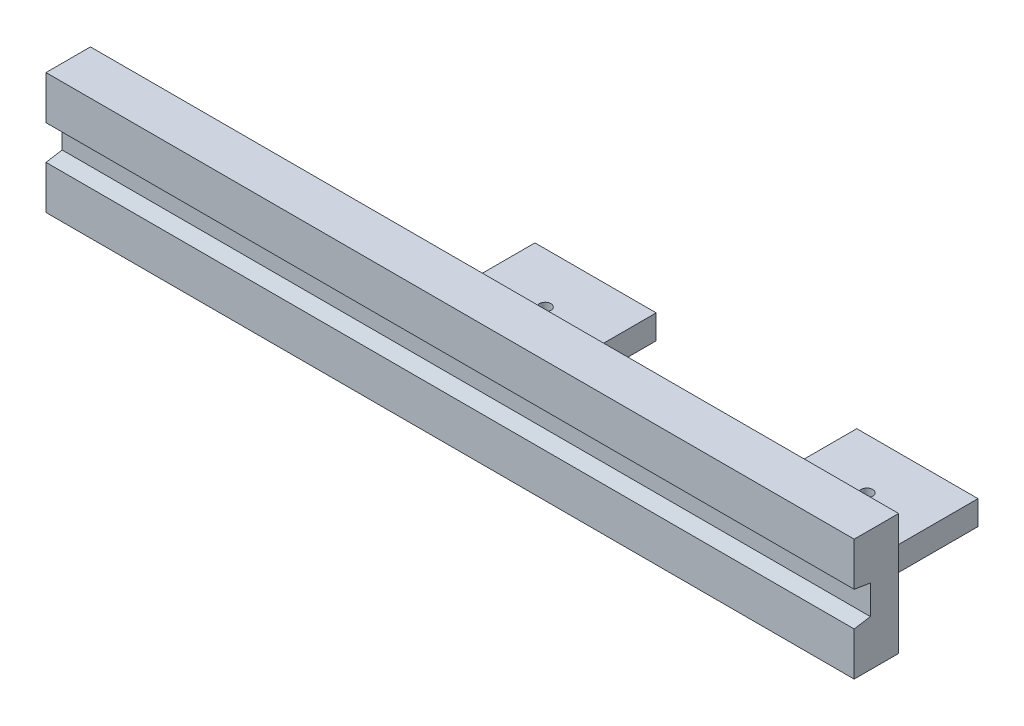
from build123d import *

# Parameters (mm, degrees)
SKETCH_1_W          = 200
SKETCH_1_H          = 30
EXTRUDE_1_DEPTH     = 11
SKETCH_4_W          = 15
SKETCH_4_H          = 3
EXTRUDE_2_DEPTH     = 25
CUT_EXTRUDE_2_DEPTH = 204.776838723
CUT_EXTRUDE_3_DEPTH = 203.358592602
SKETCH_9_W          = 30
SKETCH_9_H          = 6
EXTRUDE_3_DEPTH     = 25
CUT_EXTRUDE_4_DEPTH = 203.358592602


with BuildPart() as part:
    # 草圖1 → 填料-伸長1 (new body)
    with BuildSketch(Plane.XY):
        with Locations((100, 15)):
            Rectangle(SKETCH_1_W, SKETCH_1_H)
    extrude(amount=EXTRUDE_1_DEPTH)

    # 草圖4 → 填料-伸長2 (add)
    with BuildSketch(Plane(origin=(0, 0, 0), x_dir=(-1, 0, 0), z_dir=(0, 0, -1))):
        with Locations((-107.5, 13.5)):
            Rectangle(SKETCH_4_W, SKETCH_4_H)
        with Locations((-107.5, 16.5)):
            Rectangle(SKETCH_4_W, SKETCH_4_H)
        with Locations((-92.5, 16.5)):
            Rectangle(SKETCH_4_W, SKETCH_4_H)
        with Locations((-92.5, 13.5)):
            Rectangle(SKETCH_4_W, SKETCH_4_H)
    extrude(amount=EXTRUDE_2_DEPTH)

    # 草圖5 → 除料-伸長2 (cut, through all)
    with BuildSketch(Plane(origin=(200, 0, 0), x_dir=(0, 0, -1), z_dir=(1, 0, 0))):
        Polygon((-11, 15), (-7, 15), (-7, 18.6), (-11, 19.25), align=None)
        Polygon((-7, 11.402039536), (-7, 15), (-11, 15), (-11, 10.75), align=None)
    extrude(amount=-CUT_EXTRUDE_2_DEPTH, mode=Mode.SUBTRACT)

    # 草圖6 → 除料-伸長3 (cut, through all)
    with BuildSketch(Plane.XZ.offset(-12)):
        with BuildLine():
            ThreePointArc((101.45, -12.5), (101.025304833, -11.474695167), (100, -11.05))
            Line((100, -11.05), (100, -12.5))
            Line((100, -12.5), (101.45, -12.5))
        make_face()
        with BuildLine():
            Line((100, -12.5), (100, -11.05))
            ThreePointArc((100, -11.05), (98.974695167, -11.474695167), (98.55, -12.5))
            Line((98.55, -12.5), (100, -12.5))
        make_face()
        with BuildLine():
            Line((101.45, -12.5), (100, -12.5))
            Line((100, -12.5), (100, -13.95))
            ThreePointArc((100, -13.95), (101.025304833, -13.525304833), (101.45, -12.5))
        make_face()
        with BuildLine():
            Line((100, -13.95), (100, -12.5))
            Line((100, -12.5), (98.55, -12.5))
            ThreePointArc((98.55, -12.5), (98.974695167, -13.525304833), (100, -13.95))
        make_face()
    extrude(amount=-CUT_EXTRUDE_3_DEPTH, mode=Mode.SUBTRACT)

    # 草圖9 → 填料-伸長3 (add)
    with BuildSketch(Plane(origin=(0, 0, 0), x_dir=(-1, 0, 0), z_dir=(0, 0, -1))):
        with Locations((-179.638936631, 15)):
            Rectangle(SKETCH_9_W, SKETCH_9_H)
    extrude(amount=EXTRUDE_3_DEPTH)

    # 草圖10 → 除料-伸長4 (cut, through all)
    with BuildSketch(Plane(origin=(0, 18, 0), x_dir=(1, 0, 0), z_dir=(0, 1, 0))):
        with BuildLine():
            ThreePointArc((178.188936631, 12.5), (179.638936631, 11.05), (181.088936631, 12.5))
            Line((181.088936631, 12.5), (178.188936631, 12.5))
        make_face()
        with BuildLine():
            Line((178.188936631, 12.5), (181.088936631, 12.5))
            ThreePointArc((181.088936631, 12.5), (179.638936631, 13.95), (178.188936631, 12.5))
        make_face()
    extrude(amount=-CUT_EXTRUDE_4_DEPTH, mode=Mode.SUBTRACT)


solid = part.part
